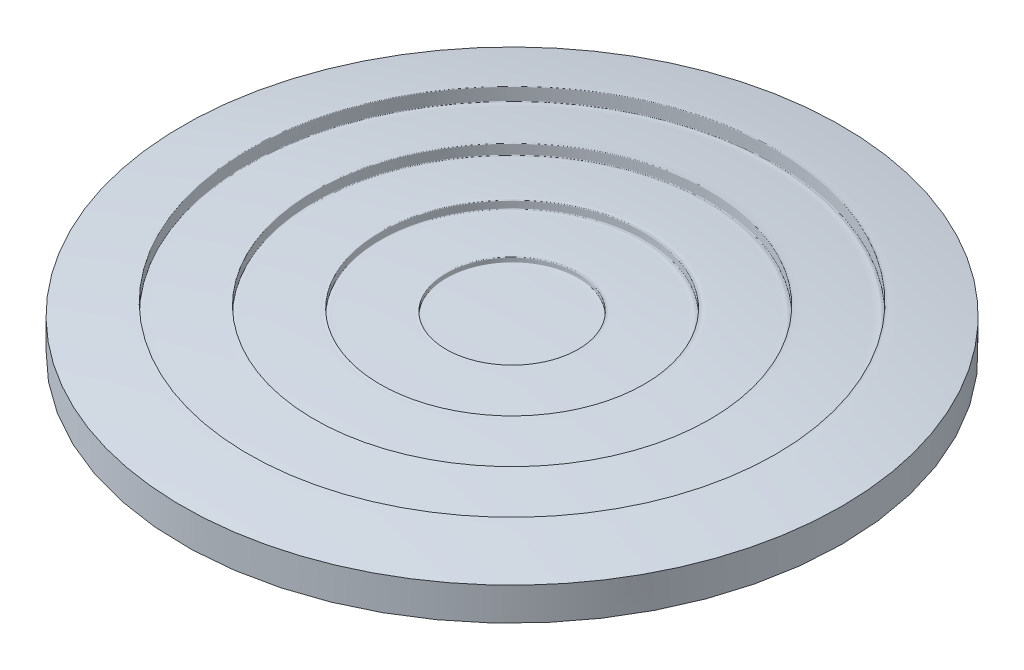
from build123d import *


with BuildPart() as part:
    # 草图1 → 旋转1 (revolve)
    with BuildSketch(Plane.XY):
        with BuildLine():
            add(Edge.make_bspline(
                [(0, 0.080032026), (0.033333339, 0.080022403), (0.10000005, 0.080003158), (0.333335056, 0.079639943), (0.833354308, 0.077408579), (1.733439399, 0.067038803), (2.500075758, 0.049793313), (3.033337018, 0.03405457), (3.166673958, 0.029915651), (3.299996449, 0.025589249), (3.400021122, 0.022211736), (3.499929272, 0.018855334), (3.600272315, 0.014946084), (3.698992229, 0.012626094), (3.803770079, 0.003900418), (3.885938119, 0.018608239), (4.002519327, -0.032647475), (3.999859573, 0.010146118), (4.000037627, 0.019960848), (3.999989918, 0.030010491), (4.000002702, 0.039997189), (3.999993567, 0.06667336), (4.000005627, 0.116660811), (3.999999357, 0.170000669), (3.999999251, 0.206667446), (4.000001084, 0.219998871), (3.999995954, 0.230004213), (4.000009026, 0.23681781), (3.999904592, 0.273781117), (4.115388683, 0.220430032), (4.19587901, 0.236582781), (4.301107004, 0.226887528), (4.399706141, 0.223991518), (4.50008159, 0.219146376), (4.599981046, 0.214696358), (4.700008052, 0.210013263), (4.866670894, 0.20209979), (5.200061206, 0.185564012), (5.866879049, 0.149515809), (6.500160378, 0.109850799), (7.000014311, 0.075278692), (7.166678663, 0.063412188), (7.299998467, 0.053729887), (7.400023137, 0.046333273), (7.499931298, 0.038962071), (7.600274328, 0.031018836), (7.698994216, 0.024733409), (7.803772454, 0.011782839), (7.885937965, 0.023232331), (8.002513124, -0.03282795), (7.999860213, 0.010151411), (8.000037456, 0.01995943), (7.999989964, 0.030010871), (8.000002689, 0.039997087), (7.999993596, 0.066673603), (8.000006402, 0.119993066), (7.999994798, 0.216672301), (8.00000067, 0.299999274), (8.000000726, 0.35666588), (7.999998948, 0.37000114), (8.000003924, 0.379995747), (7.999985354, 0.390015873), (8.000036402, 0.397326277), (7.999552757, 0.435324706), (8.115128746, 0.37765042), (8.195950985, 0.390251709), (8.301090351, 0.376405213), (8.399713154, 0.369518146), (8.500082284, 0.360637926), (8.599983428, 0.352163659), (8.700009985, 0.343452393), (8.866679794, 0.32882442), (9.200103786, 0.298850192), (9.867030736, 0.235892514), (10.500260505, 0.170635086), (11.000022511, 0.115834707), (11.16668345, 0.0972169), (11.300000521, 0.082131832), (11.400025192, 0.070680229), (11.49993335, 0.059258093), (11.600276416, 0.047243283), (11.698996096, 0.0369579), (11.803775414, 0.019734035), (11.885935797, 0.027926385), (12.00250273, -0.033063218), (11.999861283, 0.010156448), (12.000037169, 0.01995808), (11.999990041, 0.030011232), (12.000002669, 0.03999699), (11.999993646, 0.066673833), (12.000006353, 0.119992835), (11.999993647, 0.226673832), (12.000002588, 0.353330414), (11.999999713, 0.45666699), (11.999999621, 0.506667095), (12.000000549, 0.51999938), (11.999997951, 0.530002312), (12.000007648, 0.53999137), (11.999971458, 0.550032209), (12.000087105, 0.558464282), (11.998665789, 0.598875461), (12.114620672, 0.537078443), (12.196089514, 0.545743413), (12.301055911, 0.527797748), (12.399724986, 0.516853985), (12.50008174, 0.503903945), (12.599986197, 0.491361766), (12.700011869, 0.478580409), (12.866688987, 0.457165646), (13.200147224, 0.413603904), (13.933996512, 0.314386126), (14.600456707, 0.217737504), (15.100007353, 0.141691348), (15.200009173, 0.126362347), (15.300002631, 0.110939605), (15.400027306, 0.095376559), (15.499935449, 0.079846794), (15.600278601, 0.063702103), (15.698997889, 0.049361969), (15.803778981, 0.027794348), (15.885931616, 0.032715227), (16.002488096, -0.033355263), (15.999862784, 0.0101612), (16.000036767, 0.019956807), (15.999990148, 0.030011574), (16.00000264, 0.039996899), (15.999993714, 0.066674051), (16.000006284, 0.119992617), (15.999993716, 0.226674049), (16.000006051, 0.403326224), (15.999999714, 0.560000336), (16.000000095, 0.666666555), (16.000000716, 0.686665825), (15.999998963, 0.700001219), (16.00000387, 0.709995451), (15.999985557, 0.720016977), (16.000035931, 0.727328338), (15.999553848, 0.765703409), (16.115135921, 0.698089918), (16.195953865, 0.704266579), (16.301095032, 0.68175619), (16.399717184, 0.666802378), (16.500086539, 0.649691197), (16.599987614, 0.63302608), (16.700014197, 0.616109195), (16.866698042, 0.587801463), (17.200192513, 0.530431491), (17.867346578, 0.412560598), (18.667464727, 0.264034038), (19.33355745, 0.13407362), (19.666690704, 0.067488464), (19.800010055, 0.040626683), (19.90001129, 0.020379428), (19.966668128, 0.006793612), (20, 0)],
                knots=[0, 0, 0, 0, 0.004529772, 0.009059548, 0.031708657, 0.072479431, 0.131381783, 0.135913527, 0.144977427, 0.149509593, 0.154041908, 0.158574377, 0.163107006, 0.167639797, 0.172172757, 0.176705889, 0.181239199, 0.181692176, 0.182145153, 0.18259813, 0.183051107, 0.183504084, 0.186221947, 0.189845764, 0.190751719, 0.191204696, 0.191657673, 0.19211065, 0.192132466, 0.196665957, 0.201199634, 0.205733502, 0.210267565, 0.214801828, 0.219336296, 0.223870972, 0.228405862, 0.24201186, 0.269230242, 0.319155586, 0.328236773, 0.337319238, 0.341860961, 0.346403018, 0.350945413, 0.35548815, 0.360031234, 0.364574671, 0.369118464, 0.373662618, 0.374115595, 0.374568572, 0.375021549, 0.375474527, 0.375927504, 0.378645367, 0.382722161, 0.389063841, 0.389969795, 0.390422772, 0.390875749, 0.391328726, 0.391781703, 0.391876701, 0.396421221, 0.400966112, 0.405511378, 0.410057024, 0.414603054, 0.419149473, 0.423696287, 0.428243499, 0.441887574, 0.46918712, 0.519278697, 0.528392543, 0.53750842, 0.542067131, 0.546626364, 0.551186124, 0.555746415, 0.560307242, 0.564868611, 0.569430525, 0.57399299, 0.574445968, 0.574898945, 0.575351922, 0.575804899, 0.576257876, 0.578975739, 0.583052533, 0.590753144, 0.59618887, 0.597094824, 0.597547801, 0.598000779, 0.598453756, 0.598906733, 0.59935971, 0.599617351, 0.604180372, 0.608743953, 0.613308099, 0.617872815, 0.622438106, 0.627003977, 0.631570433, 0.636137478, 0.649842198, 0.677268215, 0.736771531, 0.74135349, 0.745936158, 0.750519539, 0.755103638, 0.759688461, 0.764274011, 0.768860295, 0.773447317, 0.778035082, 0.782623596, 0.783076573, 0.783529551, 0.783982528, 0.784435505, 0.784888482, 0.787606345, 0.791683139, 0.79938375, 0.811614133, 0.812973064, 0.813879019, 0.814331996, 0.814784973, 0.81523795, 0.815690927, 0.815786583, 0.820375851, 0.824965877, 0.829556666, 0.834148225, 0.838740557, 0.843333668, 0.847927564, 0.852522249, 0.86631109, 0.893910778, 0.944589656, 0.976896035, 0.986134775, 0.990755562, 0.995377302, 1, 1, 1, 1], degree=3))
            Line((20, 0), (20, -2))
            Line((20, -2), (0, -2))
            Line((0, -2), (0, 0.080032026))
        make_face()
    revolve(axis=Axis((0, -1000, 0), (0, 1, 0)))


solid = part.part
